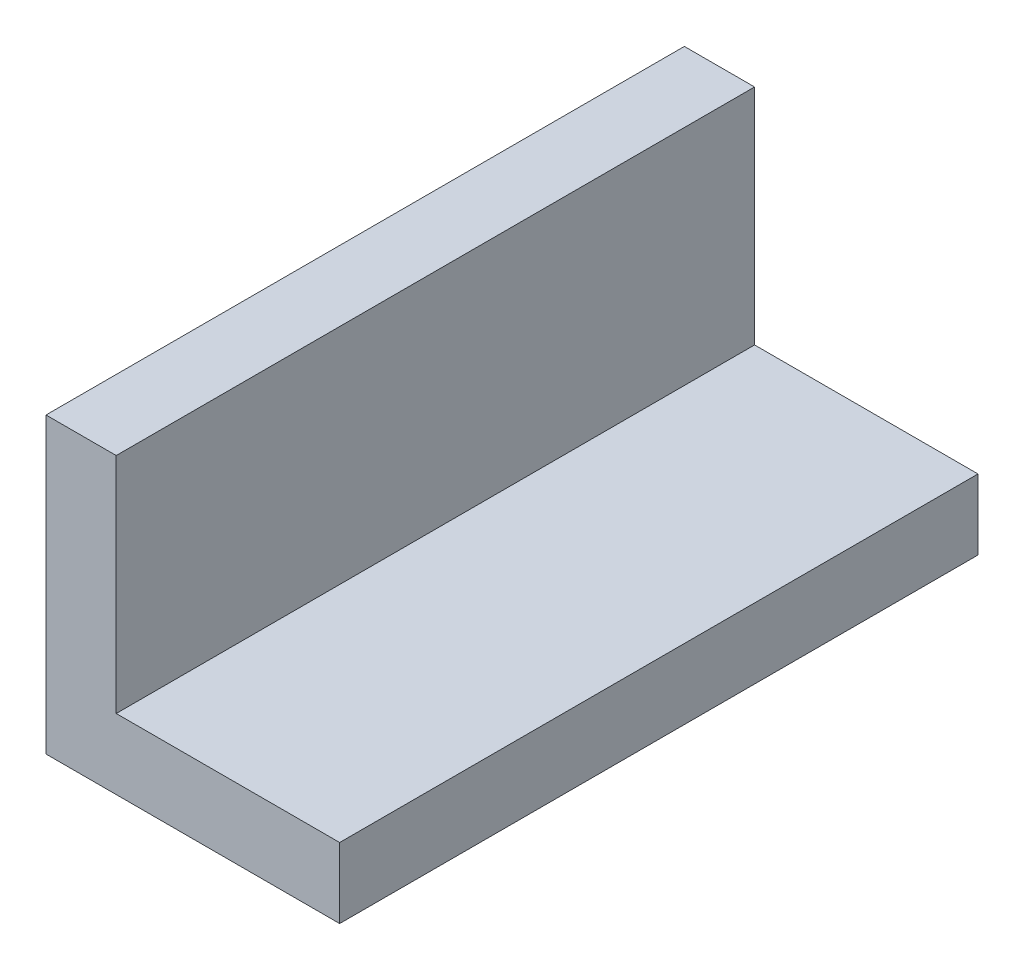
from build123d import *

# Parameters (mm, degrees)
BOSS_EXTRU_1_DEPTH = 100


with BuildPart() as part:
    # Esquisse1 → Boss.-Extru.1 (new, symmetric)
    with BuildSketch(Plane.XY):
        Polygon((11, 0), (11, 70), (-11, 70), (-11, -22), (81, -22), (81, 0), align=None)
    extrude(amount=BOSS_EXTRU_1_DEPTH, both=True)


solid = part.part
